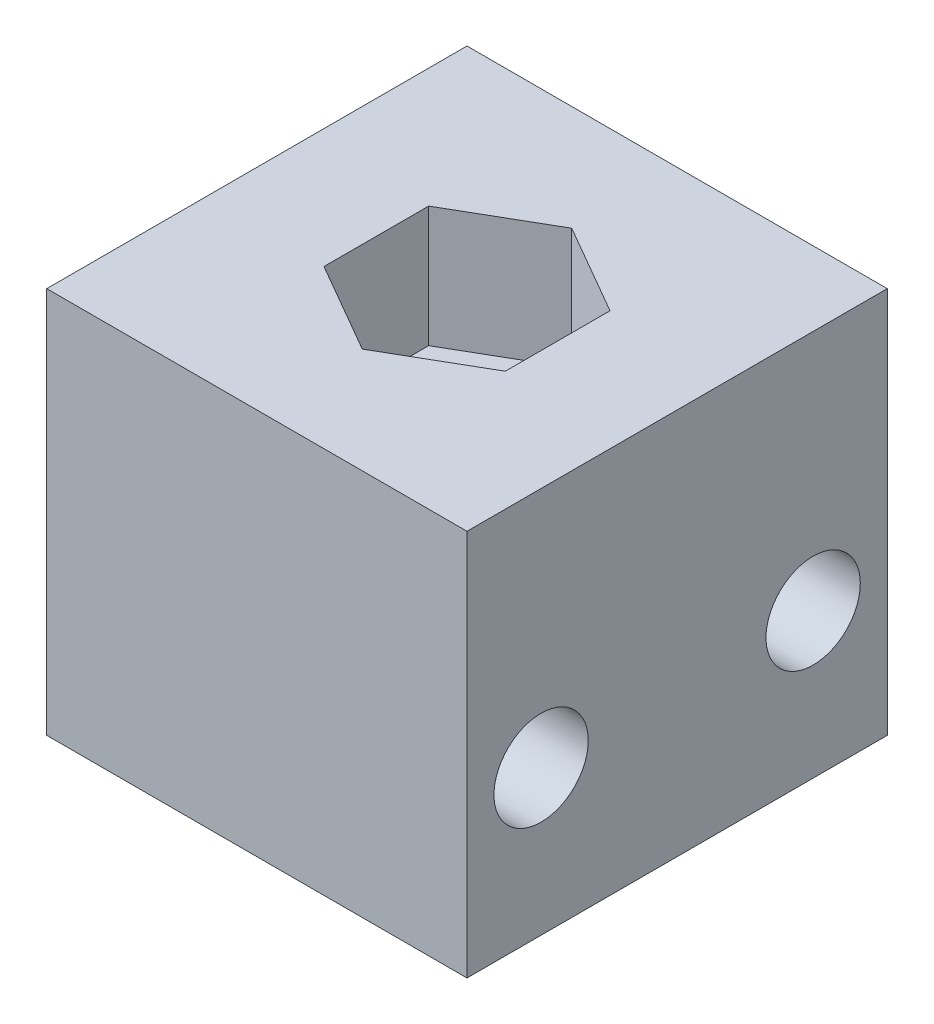
from build123d import *

# Parameters (mm, degrees)
SKETCH1_W              = 22.0726
SKETCH1_H              = 22.0726
BOSS_EXTRUDE1_DEPTH    = 20.32
F_10_CLEARANCE_HOLE1_D = 4.9784
SKETCH8_R              = 2.4765
CUT_EXTRUDE1_DEPTH     = 32.967201761
CUT_EXTRUDE2_DEPTH     = 6.35


with BuildPart() as part:
    # Sketch1 → Boss-Extrude1 (new body)
    with BuildSketch(Plane(origin=(0, 0, 0), x_dir=(1, 0, 0), z_dir=(0, 1, 0))):
        Rectangle(SKETCH1_W, SKETCH1_H)
    extrude(amount=BOSS_EXTRUDE1_DEPTH)

    # #10 Clearance Hole1 (through all)
    with Locations(Plane(origin=(0, 0, 0), x_dir=(-1, 0, 0), z_dir=(0, -1, 0))):
        with Locations((0, 0)):
            Hole(F_10_CLEARANCE_HOLE1_D / 2)

    # Sketch8 → Cut-Extrude1 (cut, through all)
    with BuildSketch(Plane(origin=(11.0363, 0, 0), x_dir=(0, 0, -1), z_dir=(1, 0, 0))):
        with Locations((-7.14375, 7.62)):
            Circle(SKETCH8_R)
        with Locations((7.14375, 7.62)):
            Circle(SKETCH8_R)
    extrude(amount=-CUT_EXTRUDE1_DEPTH, mode=Mode.SUBTRACT)

    # Sketch9 → Cut-Extrude2 (cut)
    with BuildSketch(Plane(origin=(0, 20.32, 0), x_dir=(1, 0, 0), z_dir=(0, 1, 0))):
        Polygon((0, 5.499261314), (-4.7625, 2.749630657), (-4.7625, -2.749630657), (0, -5.499261314), (4.7625, -2.749630657), (4.7625, 2.749630657), align=None)
    extrude(amount=-CUT_EXTRUDE2_DEPTH, mode=Mode.SUBTRACT)


solid = part.part
